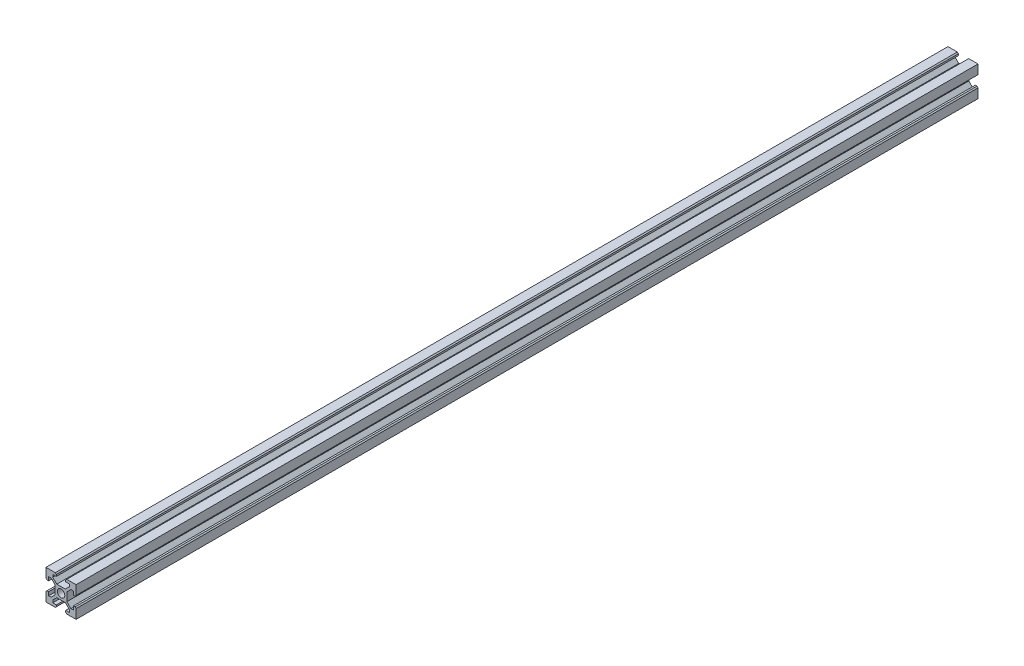
from build123d import *

# Parameters (mm, degrees)
SKETCH1_R           = 2.5
BOSS_EXTRUDE1_DEPTH = 300


with BuildPart() as part:
    # Sketch1 → Boss-Extrude1 (new, symmetric)
    with BuildSketch(Plane.XY):
        Polygon((3.9, -2.839339828), (6.560660172, -5.5), (8.200660172, -5.5), (8.200660172, -3.1), (9.3, -3.1), (10, -3.8), (10, -10), (3.8, -10), (3.1, -9.3), (3.1, -8.200660172), (5.5, -8.200660172), (5.5, -6.560660172), (2.839339828, -3.9), (-2.839339828, -3.9), (-5.5, -6.560660172), (-5.5, -8.200660172), (-3.1, -8.200660172), (-3.1, -9.3), (-3.8, -10), (-10, -10), (-10, -3.8), (-9.3, -3.1), (-8.200660172, -3.1), (-8.200660172, -5.5), (-6.560660172, -5.5), (-3.9, -2.839339828), (-3.9, 2.839339828), (-6.560660172, 5.5), (-8.200660172, 5.5), (-8.200660172, 3.1), (-9.3, 3.1), (-10, 3.8), (-10, 10), (-3.8, 10), (-3.1, 9.3), (-3.1, 8.200660172), (-5.5, 8.200660172), (-5.5, 6.560660172), (-2.839339828, 3.9), (2.839339828, 3.9), (5.5, 6.560660172), (5.5, 8.200660172), (3.1, 8.200660172), (3.1, 9.3), (3.8, 10), (10, 10), (10, 3.8), (9.3, 3.1), (8.200660172, 3.1), (8.200660172, 5.5), (6.560660172, 5.5), (3.9, 2.839339828), align=None)
        Circle(SKETCH1_R, mode=Mode.SUBTRACT)
    extrude(amount=BOSS_EXTRUDE1_DEPTH, both=True)


solid = part.part
